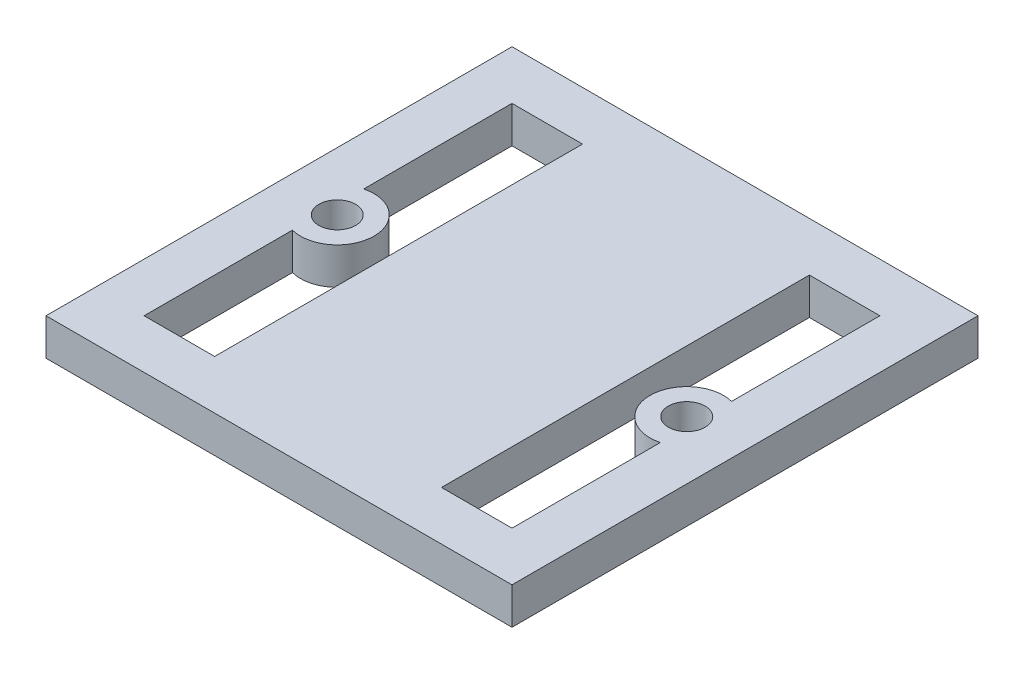
from build123d import *

# Parameters (mm, degrees)
SKETCH1_W           = 38
SKETCH1_H           = 38
SKETCH1_R           = 1.5
BOSS_EXTRUDE1_DEPTH = 3


with BuildPart() as part:
    # Sketch1 → Boss-Extrude1 (new body)
    with BuildSketch(Plane(origin=(0, 0, 0), x_dir=(1, 0, 0), z_dir=(0, 1, 0))):
        Rectangle(SKETCH1_W, SKETCH1_H)
        with BuildLine():
            ThreePointArc((-15, -2.90473751), (-11.25, 0), (-15, 2.90473751))
            Line((-15, 2.90473751), (-15, 15))
            Line((-15, 15), (-9.25, 15))
            Line((-9.25, 15), (-9.25, -15))
            Line((-9.25, -15), (-15, -15))
            Line((-15, -15), (-15, -2.90473751))
        make_face(mode=Mode.SUBTRACT)
        with Locations(Location((-14.25, 0, 0), (0, 0, 270))):
            Circle(SKETCH1_R, mode=Mode.SUBTRACT)
        with BuildLine():
            Line((15, -15), (9.25, -15))
            Line((9.25, -15), (9.25, 15))
            Line((9.25, 15), (15, 15))
            Line((15, 15), (15, 2.90473751))
            ThreePointArc((15, 2.90473751), (11.25, 0), (15, -2.90473751))
            Line((15, -2.90473751), (15, -15))
        make_face(mode=Mode.SUBTRACT)
        with Locations(Location((14.25, 0, 0), (0, 0, 270))):
            Circle(SKETCH1_R, mode=Mode.SUBTRACT)
    extrude(amount=BOSS_EXTRUDE1_DEPTH)


solid = part.part
